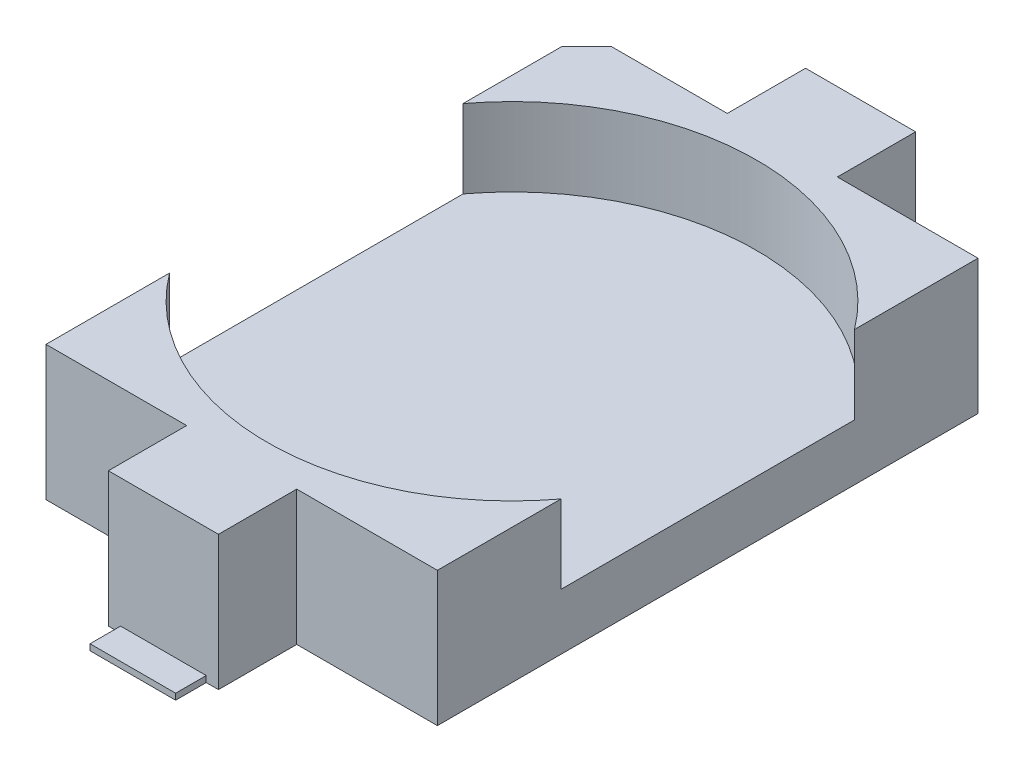
from build123d import *

# Parameters (mm, degrees)
SKETCH1_W           = 5.75
SKETCH1_H           = 22.1
SKETCH1_W_2         = 4.5
SKETCH1_H_2         = 3.2
BOSS_EXTRUDE1_DEPTH = 5.5
SKETCH2_R           = 10
CUT_EXTRUDE1_DEPTH  = 3.2
CHAMFER1_SIZE       = 1
SKETCH3_W           = 3.5
SKETCH3_H           = 31
BOSS_EXTRUDE2_DEPTH = 0.25


with BuildPart() as part:
    # Sketch1 → Boss-Extrude1 (new body)
    with BuildSketch(Plane(origin=(0, 0, 0), x_dir=(1, 0, 0), z_dir=(0, 1, 0))):
        with Locations((-5.125, 0)):
            Rectangle(SKETCH1_W, SKETCH1_H)
        Rectangle(SKETCH1_W_2, SKETCH1_H)
        with Locations((0, 12.65)):
            Rectangle(SKETCH1_W_2, SKETCH1_H_2)
        with Locations((0, -12.65)):
            Rectangle(SKETCH1_W_2, SKETCH1_H_2)
        with Locations((5.125, 0)):
            Rectangle(SKETCH1_W, SKETCH1_H)
    extrude(amount=BOSS_EXTRUDE1_DEPTH)

    # Sketch2 → Cut-Extrude1 (cut)
    with BuildSketch(Plane(origin=(0, 5.5, 0), x_dir=(1, 0, 0), z_dir=(0, 1, 0))):
        Circle(SKETCH2_R)
    extrude(amount=-CUT_EXTRUDE1_DEPTH, mode=Mode.SUBTRACT)

    # Chamfer1
    chamfer1_edges = [part.edges().sort_by_distance(p)[0] for p in [
        (-8, 2.75, -11.05),
    ]]
    chamfer(chamfer1_edges, length=CHAMFER1_SIZE)

    # Sketch3 → Boss-Extrude2 (add)
    with BuildSketch(Plane.XZ):
        Rectangle(SKETCH3_W, SKETCH3_H)
    extrude(amount=-BOSS_EXTRUDE2_DEPTH)


solid = part.part
